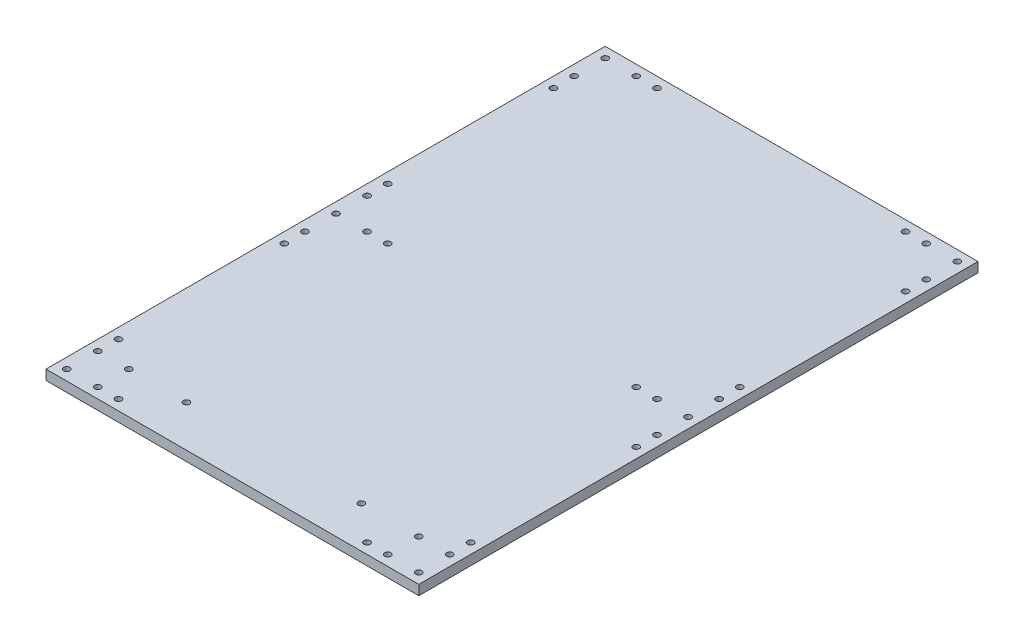
from build123d import *

# Parameters (mm, degrees)
SKETCH1_W             = 360
SKETCH1_H             = 540
BOSS_EXTRUDE1_DEPTH   = 9.525
F_6_0MM_DOWEL_HOLE3_D = 6
F_6_0MM_DOWEL_HOLE2_D = 6
F_6_0MM_DOWEL_HOLE1_D = 6


with BuildPart() as part:
    # Sketch1 → Boss-Extrude1 (new body)
    with BuildSketch(Plane(origin=(0, 0, 0), x_dir=(1, 0, 0), z_dir=(0, 1, 0))):
        with Locations((180, 270)):
            Rectangle(SKETCH1_W, SKETCH1_H)
    extrude(amount=BOSS_EXTRUDE1_DEPTH)

    # Ø6.0mm Dowel Hole3 (through all)
    with Locations(Plane(origin=(0, 9.525, 0), x_dir=(1, 0, 0), z_dir=(0, 1, 0))):
        with Locations((40, 40), (95.5625, 40), (264.4375, 40), (320, 40)):
            Hole(F_6_0MM_DOWEL_HOLE3_D / 2)

    # Ø6.0mm Dowel Hole2 (through all)
    with Locations(Plane(origin=(0, 9.525, 0), x_dir=(1, 0, 0), z_dir=(0, 1, 0))):
        with Locations((40, 10), (10, 40), (320, 10), (350, 40), (10, 240), (40, 270), (10, 300), (350, 240), (320, 270), (350, 300), (10, 500), (40, 530), (320, 530), (350, 500), (10, 480), (60, 530), (300, 530), (350, 480), (350, 320), (300, 270), (350, 220), (10, 220), (60, 270), (10, 320), (10, 60), (60, 10), (300, 10), (350, 60)):
            Hole(F_6_0MM_DOWEL_HOLE2_D / 2)

    # Ø6.0mm Dowel Hole1 (through all)
    with Locations(Plane(origin=(0, 9.525, 0), x_dir=(1, 0, 0), z_dir=(0, 1, 0))):
        with Locations((10, 10), (350, 10), (350, 530), (10, 530), (10, 270), (350, 270)):
            Hole(F_6_0MM_DOWEL_HOLE1_D / 2)


solid = part.part
